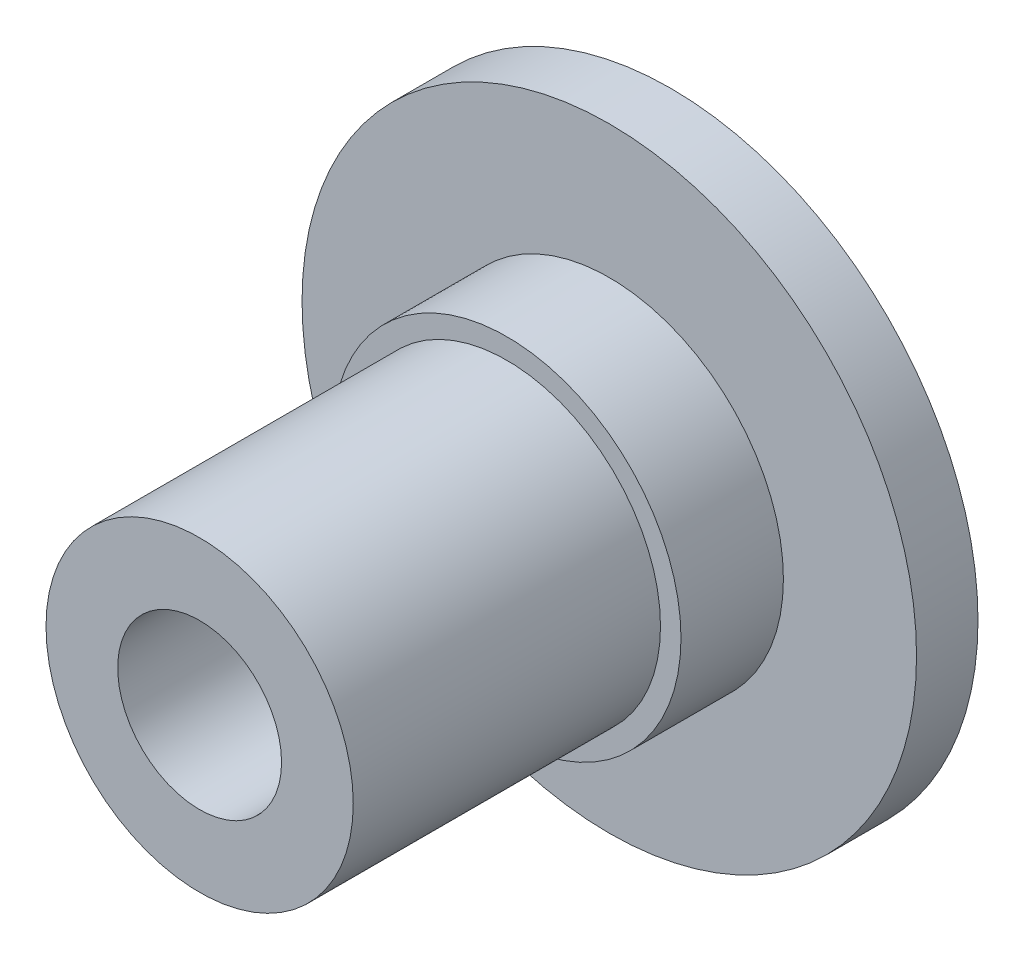
from build123d import *

# Parameters (mm, degrees)
SKETCH_1_R          = 15
EXTRUDE_1_DEPTH     = 3
SKETCH_2_R          = 8.5
EXTRUDE_2_DEPTH     = 20
SKETCH_3_R          = 10.332882869
SKETCH_3_R_2        = 7.5
CUT_EXTRUDE_1_DEPTH = 15
SKETCH_4_R          = 4
CUT_EXTRUDE_2_DEPTH = 37
CHAMFER_1_SIZE      = 2.8


with BuildPart() as part:
    # Эскиз1 → Бобышка-Вытянуть1 (new body)
    with BuildSketch(Plane.XY):
        Circle(SKETCH_1_R)
    extrude(amount=EXTRUDE_1_DEPTH)

    # Эскиз2 → Бобышка-Вытянуть2 (add)
    with BuildSketch(Plane.XY.offset(3)):
        Circle(SKETCH_2_R)
    extrude(amount=EXTRUDE_2_DEPTH)

    # Эскиз3 → Вырез-Вытянуть1 (cut)
    with BuildSketch(Plane.XY.offset(23)):
        Circle(SKETCH_3_R)
        Circle(SKETCH_3_R_2, mode=Mode.SUBTRACT)
    extrude(amount=-CUT_EXTRUDE_1_DEPTH, mode=Mode.SUBTRACT)

    # Эскиз4 → Вырез-Вытянуть2 (cut)
    with BuildSketch(Plane.XY.offset(23)):
        Circle(SKETCH_4_R)
    extrude(amount=-CUT_EXTRUDE_2_DEPTH, mode=Mode.SUBTRACT)

    # Фаска1
    chamfer_1_edges = [part.edges().sort_by_distance(p)[0] for p in [
        (-4, 0, 0),
    ]]
    chamfer(chamfer_1_edges, length=CHAMFER_1_SIZE)


solid = part.part
